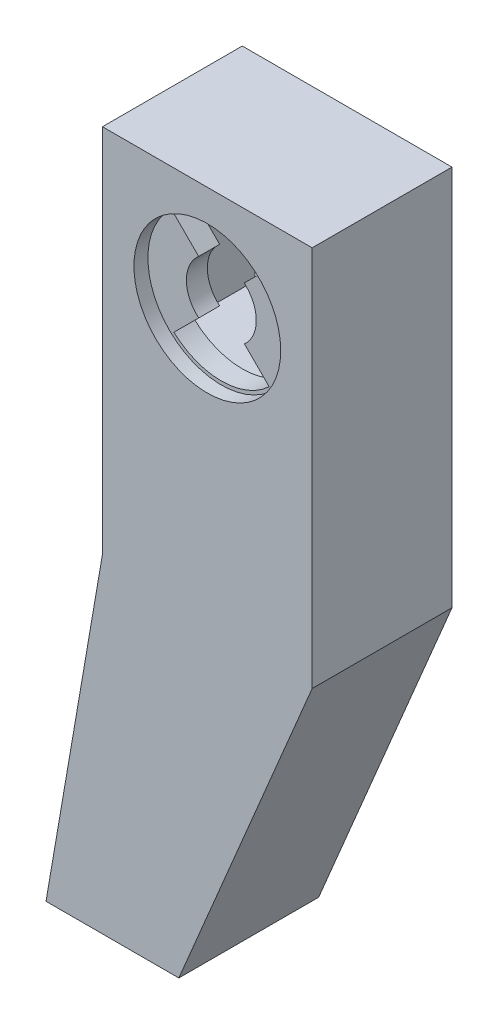
from build123d import *

# Parameters (mm, degrees)
SKETCH1_25_W        = 26.4
SKETCH1_25_H        = 26.4
BOSS_EXTRUDE8_DEPTH = 20
SKETCH1_27_W        = 26.4
SKETCH1_27_H        = 26.4
BOSS_EXTRUDE9_DEPTH = 5
SKETCH1_R           = 10.5
CUT_EXTRUDE3_DEPTH  = 2
SKETCH4_R           = 1.4
CUT_EXTRUDE4_DEPTH  = 15


with BuildPart() as part:
    # Sketch1<25> → Boss-Extrude8 (new body)
    with BuildSketch(Plane.XY):
        Polygon((-46.914285714, 29.828571429), (-46.914285714, -1.887541502), (-46.914285714, -23.131847808), (-54.990816107, -70.171428571), (-35.990816107, -70.171428571), (-16.914285714, -24.770069728), (-16.914285714, -1.887541502), (-16.914285714, 29.828571429), align=None)
        with Locations((-31.914285714, 14.828571429)):
            Rectangle(SKETCH1_25_W, SKETCH1_25_H, mode=Mode.SUBTRACT)
    extrude(amount=-BOSS_EXTRUDE8_DEPTH)

    # Sketch1<27> → Boss-Extrude9 (add)
    with BuildSketch(Plane.XY):
        with Locations((-31.914285714, 14.828571429)):
            Rectangle(SKETCH1_27_W, SKETCH1_27_H)
        with BuildLine():
            Line((-28.605725915, 18.638938958), (-25.098574601, 22.146090272))
            ThreePointArc((-25.098574601, 22.146090272), (-31.889127352, 24.828539781), (-38.693091307, 22.180291958))
            Line((-38.693091307, 22.180291958), (-35.151738307, 18.638938958))
            ThreePointArc((-35.151738307, 18.638938958), (-36.914285714, 14.828571429), (-35.151738307, 11.018203899))
            Line((-35.151738307, 11.018203899), (-38.693091307, 7.4768509))
            ThreePointArc((-38.693091307, 7.4768509), (-31.867344715, 4.828681602), (-25.066760197, 7.540814964))
            Line((-25.066760197, 7.540814964), (-28.605725915, 11.079780683))
            ThreePointArc((-28.605725915, 11.079780683), (-26.916711196, 14.672850745), (-28.378751808, 18.364105335))
            Line((-28.378751808, 18.364105335), (-28.605725915, 18.638938958))
        make_face(mode=Mode.SUBTRACT)
    extrude(amount=-BOSS_EXTRUDE9_DEPTH)

    # Sketch1 → Cut-Extrude3 (cut)
    with BuildSketch(Plane.XY):
        with Locations((-31.914285714, 14.828571429)):
            Circle(SKETCH1_R)
    extrude(amount=-CUT_EXTRUDE3_DEPTH, mode=Mode.SUBTRACT)

    # Sketch4 → Cut-Extrude4 (cut)
    with BuildSketch(Plane(origin=(0, -70.171428571, 0), x_dir=(-1, 0, 0), z_dir=(0, -1, 0))):
        with Locations((40.990816107, 12)):
            Circle(SKETCH4_R)
        with Locations((49.990816107, 12)):
            Circle(SKETCH4_R)
    extrude(amount=-CUT_EXTRUDE4_DEPTH, mode=Mode.SUBTRACT)


solid = part.part
